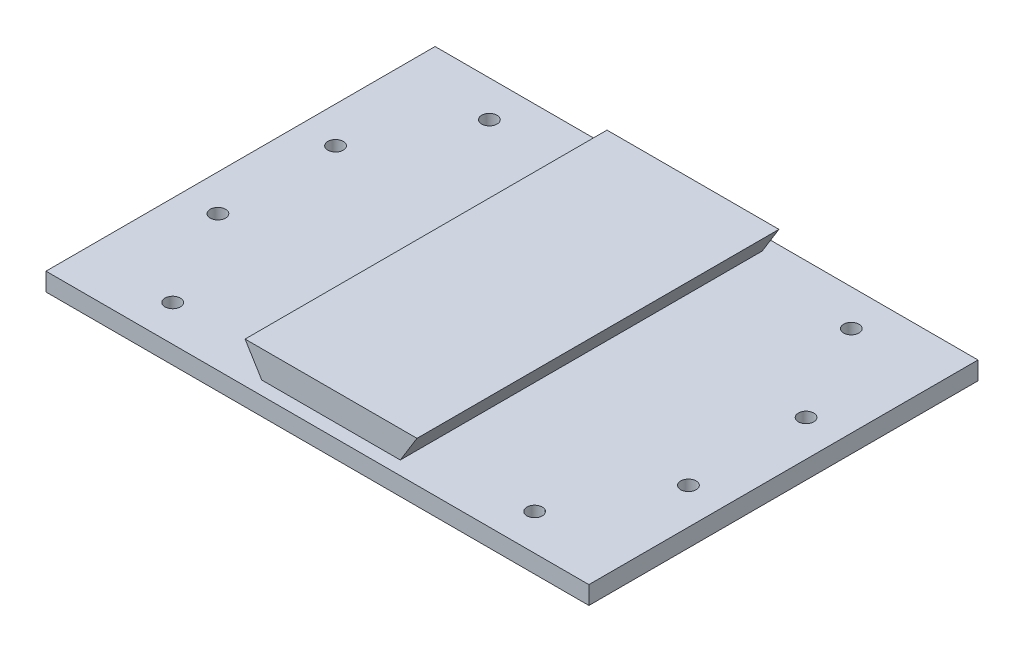
from build123d import *

# Parameters (mm, degrees)
SKETCH1_W             = 120
SKETCH1_H             = 86
RAIL_PLATE_DEPTH      = 4
DOVETAIL_RAIL_DEPTH   = 40
BOLT_HOLES_DEPTH      = 75.491610266
BOLT_HOLES_DEPTH_BACK = 75.491610266
SKETCH3_R             = 1.7


with BuildPart() as part:
    # Sketch1 → Rail Plate (new body)
    with BuildSketch(Plane(origin=(0, 0, 0), x_dir=(1, 0, 0), z_dir=(0, 1, 0))):
        Rectangle(SKETCH1_W, SKETCH1_H)
    extrude(amount=RAIL_PLATE_DEPTH)

    # Sketch2 → Dovetail Rail (add, symmetric)
    with BuildSketch(Plane.XY):
        Polygon((-15, 3.5), (15, 3.5), (19, 10), (-19, 10), align=None)
    extrude(amount=DOVETAIL_RAIL_DEPTH, both=True)

    # Sketch3 → Bolt Holes (cut, two sides: drawn at the far end of the back side and taken through both)
    with BuildSketch(Plane(origin=(0, 0, 0), x_dir=(1, 0, 0), z_dir=(0, 1, 0)).offset(-BOLT_HOLES_DEPTH_BACK)):
        with Locations(Location((-40, -35, 0), (0, 0, 270))):
            Circle(SKETCH3_R)
        with Locations(Location((-40, 35, 0), (0, 0, 270))):
            Circle(SKETCH3_R)
        with Locations(Location((40, -35, 0), (0, 0, 270))):
            Circle(SKETCH3_R)
        with Locations(Location((40, 35, 0), (0, 0, 270))):
            Circle(SKETCH3_R)
        with Locations(Location((-52, -13, 0), (0, 0, 270))):
            Circle(SKETCH3_R)
        with Locations(Location((-52, 13, 0), (0, 0, 270))):
            Circle(SKETCH3_R)
        with Locations(Location((52, -13, 0), (0, 0, 270))):
            Circle(SKETCH3_R)
        with Locations(Location((52, 13, 0), (0, 0, 270))):
            Circle(SKETCH3_R)
    extrude(amount=BOLT_HOLES_DEPTH + BOLT_HOLES_DEPTH_BACK, mode=Mode.SUBTRACT)


solid = part.part
